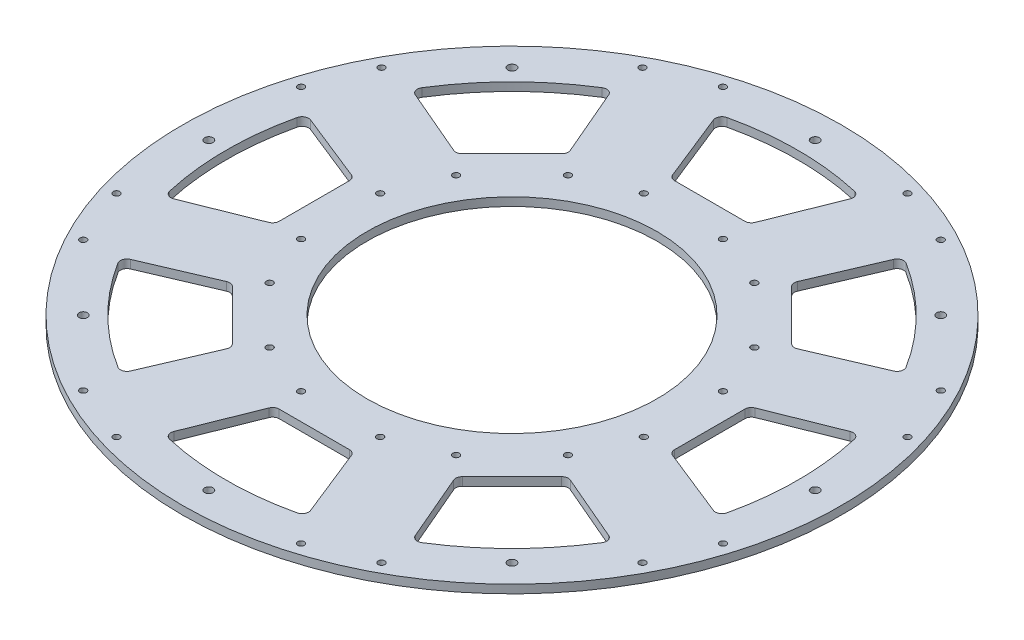
from build123d import *

# Parameters (mm, degrees)
SKETCH1_R                   = 250
SKETCH1_R_2                 = 110
BOSS_EXTRUDE1_DEPTH         = 6.35
M6_CLEARANCE_HOLE1_D        = 6.4
TAP_DRILL_FOR_M6X1_0_TAP2_D = 5
CIRPATTERN1_COUNT           = 8


with BuildPart() as part:
    # Sketch1 → Boss-Extrude1 (new body)
    with BuildSketch(Plane(origin=(0, 0, 0), x_dir=(1, 0, 0), z_dir=(0, 1, 0))):
        with Locations(Location((0, 0, 0), (0, 0, 270))):
            Circle(SKETCH1_R)
        with Locations(Location((0, 0, 0), (0, 0, 270))):
            Circle(SKETCH1_R_2, mode=Mode.SUBTRACT)
        with BuildLine():
            Line((-26.614835193, 150), (26.614835193, 150))
            ThreePointArc((26.614835193, 150), (29.417979239, 150.859663848), (31.257218647, 153.143046618))
            Line((31.257218647, 153.143046618), (51.858276397, 204.645690993))
            ThreePointArc((51.858276397, 204.645690993), (51.644491556, 208.823746337), (48.330359895, 211.376858507))
            ThreePointArc((48.330359895, 211.376858507), (0, 216.831731995), (-48.330359895, 211.376858507))
            ThreePointArc((-48.330359895, 211.376858507), (-51.644491556, 208.823746337), (-51.858276397, 204.645690993))
            Line((-51.858276397, 204.645690993), (-31.257218647, 153.143046618))
            ThreePointArc((-31.257218647, 153.143046618), (-29.417979239, 150.859663848), (-26.614835193, 150))
        make_face(mode=Mode.SUBTRACT)
        with BuildLine():
            Line((86.186295489, 130.390678022), (108.037016941, 181.375694743))
            ThreePointArc((108.037016941, 181.375694743), (111.142516918, 184.178857298), (115.291284818, 183.640735255))
            ThreePointArc((115.291284818, 183.640735255), (153.32318807, 153.32318807), (183.640735255, 115.291284818))
            ThreePointArc((183.640735255, 115.291284818), (184.178857298, 111.142516918), (181.375694743, 108.037016941))
            Line((181.375694743, 108.037016941), (130.390678022, 86.186295489))
            ThreePointArc((130.390678022, 86.186295489), (127.475543923, 85.872238705), (124.885547623, 87.246486733))
            Line((124.885547623, 87.246486733), (87.246486733, 124.885547623))
            ThreePointArc((87.246486733, 124.885547623), (85.872238705, 127.475543923), (86.186295489, 130.390678022))
        make_face(mode=Mode.SUBTRACT)
        with BuildLine():
            Line((153.143046618, 31.257218647), (204.645690993, 51.858276397))
            ThreePointArc((204.645690993, 51.858276397), (208.823746337, 51.644491556), (211.376858507, 48.330359895))
            ThreePointArc((211.376858507, 48.330359895), (216.831731995, 0), (211.376858507, -48.330359895))
            ThreePointArc((211.376858507, -48.330359895), (208.823746337, -51.644491556), (204.645690993, -51.858276397))
            Line((204.645690993, -51.858276397), (153.143046618, -31.257218647))
            ThreePointArc((153.143046618, -31.257218647), (150.859663848, -29.417979239), (150, -26.614835193))
            Line((150, -26.614835193), (150, 26.614835193))
            ThreePointArc((150, 26.614835193), (150.859663848, 29.417979239), (153.143046618, 31.257218647))
        make_face(mode=Mode.SUBTRACT)
        with BuildLine():
            Line((130.390678022, -86.186295489), (181.375694743, -108.037016941))
            ThreePointArc((181.375694743, -108.037016941), (184.178857298, -111.142516918), (183.640735255, -115.291284818))
            ThreePointArc((183.640735255, -115.291284818), (153.32318807, -153.32318807), (115.291284818, -183.640735255))
            ThreePointArc((115.291284818, -183.640735255), (111.142516918, -184.178857298), (108.037016941, -181.375694743))
            Line((108.037016941, -181.375694743), (86.186295489, -130.390678022))
            ThreePointArc((86.186295489, -130.390678022), (85.872238705, -127.475543923), (87.246486733, -124.885547623))
            Line((87.246486733, -124.885547623), (124.885547623, -87.246486733))
            ThreePointArc((124.885547623, -87.246486733), (127.475543923, -85.872238705), (130.390678022, -86.186295489))
        make_face(mode=Mode.SUBTRACT)
        with BuildLine():
            Line((31.257218647, -153.143046618), (51.858276397, -204.645690993))
            ThreePointArc((51.858276397, -204.645690993), (51.644491556, -208.823746337), (48.330359895, -211.376858507))
            ThreePointArc((48.330359895, -211.376858507), (0, -216.831731995), (-48.330359895, -211.376858507))
            ThreePointArc((-48.330359895, -211.376858507), (-51.644491556, -208.823746337), (-51.858276397, -204.645690993))
            Line((-51.858276397, -204.645690993), (-31.257218647, -153.143046618))
            ThreePointArc((-31.257218647, -153.143046618), (-29.417979239, -150.859663848), (-26.614835193, -150))
            Line((-26.614835193, -150), (26.614835193, -150))
            ThreePointArc((26.614835193, -150), (29.417979239, -150.859663848), (31.257218647, -153.143046618))
        make_face(mode=Mode.SUBTRACT)
        with BuildLine():
            Line((-86.186295489, -130.390678022), (-108.037016941, -181.375694743))
            ThreePointArc((-108.037016941, -181.375694743), (-111.142516918, -184.178857298), (-115.291284818, -183.640735255))
            ThreePointArc((-115.291284818, -183.640735255), (-153.32318807, -153.32318807), (-183.640735255, -115.291284818))
            ThreePointArc((-183.640735255, -115.291284818), (-184.178857298, -111.142516918), (-181.375694743, -108.037016941))
            Line((-181.375694743, -108.037016941), (-130.390678022, -86.186295489))
            ThreePointArc((-130.390678022, -86.186295489), (-127.475543923, -85.872238705), (-124.885547623, -87.246486733))
            Line((-124.885547623, -87.246486733), (-87.246486733, -124.885547623))
            ThreePointArc((-87.246486733, -124.885547623), (-85.872238705, -127.475543923), (-86.186295489, -130.390678022))
        make_face(mode=Mode.SUBTRACT)
        with BuildLine():
            Line((-153.143046618, -31.257218647), (-204.645690993, -51.858276397))
            ThreePointArc((-204.645690993, -51.858276397), (-208.823746337, -51.644491556), (-211.376858507, -48.330359895))
            ThreePointArc((-211.376858507, -48.330359895), (-216.831731995, 0), (-211.376858507, 48.330359895))
            ThreePointArc((-211.376858507, 48.330359895), (-208.823746337, 51.644491556), (-204.645690993, 51.858276397))
            Line((-204.645690993, 51.858276397), (-153.143046618, 31.257218647))
            ThreePointArc((-153.143046618, 31.257218647), (-150.859663848, 29.417979239), (-150, 26.614835193))
            Line((-150, 26.614835193), (-150, -26.614835193))
            ThreePointArc((-150, -26.614835193), (-150.859663848, -29.417979239), (-153.143046618, -31.257218647))
        make_face(mode=Mode.SUBTRACT)
        with BuildLine():
            Line((-130.390678022, 86.186295489), (-181.375694743, 108.037016941))
            ThreePointArc((-181.375694743, 108.037016941), (-184.178857298, 111.142516918), (-183.640735255, 115.291284818))
            ThreePointArc((-183.640735255, 115.291284818), (-153.32318807, 153.32318807), (-115.291284818, 183.640735255))
            ThreePointArc((-115.291284818, 183.640735255), (-111.142516918, 184.178857298), (-108.037016941, 181.375694743))
            Line((-108.037016941, 181.375694743), (-86.186295489, 130.390678022))
            ThreePointArc((-86.186295489, 130.390678022), (-85.872238705, 127.475543923), (-87.246486733, 124.885547623))
            Line((-87.246486733, 124.885547623), (-124.885547623, 87.246486733))
            ThreePointArc((-124.885547623, 87.246486733), (-127.475543923, 85.872238705), (-130.390678022, 86.186295489))
        make_face(mode=Mode.SUBTRACT)
    extrude(amount=-BOSS_EXTRUDE1_DEPTH)

    # M6 Clearance Hole1 (through all)
    with Locations(Plane(origin=(0, 0, -230), x_dir=(0, 0, 1), z_dir=(0, 1, 0))):
        with Locations((0, 0), (67.365440327, -162.634559673), (230, -230), (67.365440327, 162.634559673), (230, 230), (392.634559673, 162.634559673), (460, 0), (392.634559673, -162.634559673)):
            Hole(M6_CLEARANCE_HOLE1_D / 2)

    # Tap Drill for M6x1.0 Tap2 (through all)
    with Locations(Plane(origin=(-70, 0, -230), x_dir=(0, 0, 1), z_dir=(0, 1, 0))):
        with Locations((0, 0), (0, 140), (100, 100), (100, 40)):
            tap_drill_for_m6x1_0_tap2 = Hole(TAP_DRILL_FOR_M6X1_0_TAP2_D / 2)

    # CirPattern1: Tap Drill for M6x1.0 Tap2 ×8 about axis
    cirpattern1_axis = Axis((0, 0, 0), (0, 1, 0))
    for i in range(1, CIRPATTERN1_COUNT):
        add(tap_drill_for_m6x1_0_tap2.rotate(cirpattern1_axis, i * 360 / CIRPATTERN1_COUNT), mode=Mode.SUBTRACT)


solid = part.part
